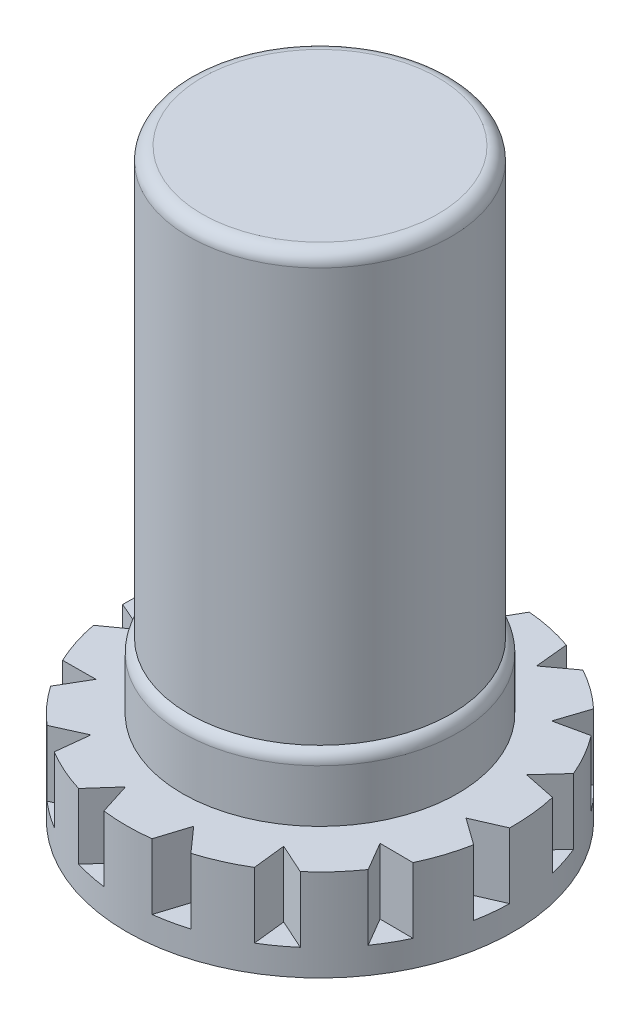
from build123d import *

# Parameters (mm, degrees)
ESBO_O1_R                = 2.95
RESSALTO_EXTRUS_O1_DEPTH = 1.4
CORTE_EXTRUS_O1_START    = -1
CORTE_EXTRUS_O1_DEPTH    = 1
ESBO_O3_R                = 2.1
RESSALTO_EXTRUS_O2_DEPTH = 1
FILETE3_R                = 0.2
ESBO_O4_R                = 2
RESSALTO_EXTRUS_O3_DEPTH = 6.5
FILETE4_R                = 0.2


with BuildPart() as part:
    # Esboço1 → Ressalto-extrusão1 (new body)
    with BuildSketch(Plane(origin=(0, 0, 0), x_dir=(1, 0, 0), z_dir=(0, 1, 0))):
        with Locations(Location((0, 0, 0), (0, 0, 270))):
            Circle(ESBO_O1_R)
    extrude(amount=RESSALTO_EXTRUS_O1_DEPTH)

    # Esboço2 → Corte-extrusão1 (cut)
    with BuildSketch(Plane(origin=(0, 1.4, 0), x_dir=(1, 0, 0), z_dir=(0, 1, 0)).offset(CORTE_EXTRUS_O1_START)):
        with BuildLine():
            Line((-0.25, 2.939387691), (0, 2.5))
            Line((0, 2.5), (0.25, 2.939387691))
            ThreePointArc((0.25, 2.939387691), (0, 2.95), (-0.25, 2.939387691))
        make_face()
        with BuildLine():
            Line((1.016841608, 2.283863644), (1.423943047, 2.583580113))
            ThreePointArc((1.423943047, 2.583580113), (1.199873097, 2.6949591), (0.967170318, 2.786948434))
            Line((0.967170318, 2.786948434), (1.016841608, 2.283863644))
        make_face()
        with BuildLine():
            Line((1.857862064, 1.672826516), (2.351673404, 1.781048062))
            ThreePointArc((2.351673404, 1.781048062), (2.192277235, 1.973935289), (2.017108101, 2.152620475))
            Line((2.017108101, 2.152620475), (1.857862064, 1.672826516))
        make_face()
        with BuildLine():
            Line((2.377641291, 0.772542486), (2.872778066, 0.670556621))
            ThreePointArc((2.872778066, 0.670556621), (2.805616723, 0.911600133), (2.718269569, 1.146084879))
            Line((2.718269569, 1.146084879), (2.377641291, 0.772542486))
        make_face()
        with BuildLine():
            Line((2.486304738, -0.261321158), (2.897153302, -0.555880152))
            ThreePointArc((2.897153302, -0.555880152), (2.933839591, -0.308358967), (2.949417534, -0.058619204))
            Line((2.949417534, -0.058619204), (2.486304738, -0.261321158))
        make_face()
        with BuildLine():
            Line((2.165063509, -1.25), (2.420584412, -1.686200197))
            ThreePointArc((2.420584412, -1.686200197), (2.554774941, -1.475), (2.670584412, -1.253187495))
            Line((2.670584412, -1.253187495), (2.165063509, -1.25))
        make_face()
        with BuildLine():
            Line((1.469463131, -2.022542486), (1.525474487, -2.524960908))
            ThreePointArc((1.525474487, -2.524960908), (1.733966494, -2.386600133), (1.929982984, -2.231068282))
            Line((1.929982984, -2.231068282), (1.469463131, -2.022542486))
        make_face()
        with BuildLine():
            Line((0.519779227, -2.445369002), (0.366596165, -2.927132941))
            ThreePointArc((0.366596165, -2.927132941), (0.613339488, -2.885535422), (0.855669965, -2.823177095))
            Line((0.855669965, -2.823177095), (0.519779227, -2.445369002))
        make_face()
        with BuildLine():
            Line((-0.519779227, -2.445369002), (-0.855669965, -2.823177095))
            ThreePointArc((-0.855669965, -2.823177095), (-0.613339488, -2.885535422), (-0.366596165, -2.927132941))
            Line((-0.366596165, -2.927132941), (-0.519779227, -2.445369002))
        make_face()
        with BuildLine():
            Line((-1.469463131, -2.022542486), (-1.929982984, -2.231068282))
            ThreePointArc((-1.929982984, -2.231068282), (-1.733966494, -2.386600133), (-1.525474487, -2.524960908))
            Line((-1.525474487, -2.524960908), (-1.469463131, -2.022542486))
        make_face()
        with BuildLine():
            Line((-2.165063509, -1.25), (-2.670584412, -1.253187495))
            ThreePointArc((-2.670584412, -1.253187495), (-2.554774941, -1.475), (-2.420584412, -1.686200197))
            Line((-2.420584412, -1.686200197), (-2.165063509, -1.25))
        make_face()
        with BuildLine():
            Line((-2.486304738, -0.261321158), (-2.949417534, -0.058619204))
            ThreePointArc((-2.949417534, -0.058619204), (-2.933839591, -0.308358967), (-2.897153302, -0.555880152))
            Line((-2.897153302, -0.555880152), (-2.486304738, -0.261321158))
        make_face()
        with BuildLine():
            Line((-2.377641291, 0.772542486), (-2.718269569, 1.146084879))
            ThreePointArc((-2.718269569, 1.146084879), (-2.805616723, 0.911600133), (-2.872778066, 0.670556621))
            Line((-2.872778066, 0.670556621), (-2.377641291, 0.772542486))
        make_face()
        with BuildLine():
            Line((-1.857862064, 1.672826516), (-2.017108101, 2.152620475))
            ThreePointArc((-2.017108101, 2.152620475), (-2.192277235, 1.973935289), (-2.351673404, 1.781048062))
            Line((-2.351673404, 1.781048062), (-1.857862064, 1.672826516))
        make_face()
        with BuildLine():
            Line((-1.016841608, 2.283863644), (-0.967170318, 2.786948434))
            ThreePointArc((-0.967170318, 2.786948434), (-1.199873097, 2.6949591), (-1.423943047, 2.583580113))
            Line((-1.423943047, 2.583580113), (-1.016841608, 2.283863644))
        make_face()
    extrude(amount=CORTE_EXTRUS_O1_DEPTH, mode=Mode.SUBTRACT)

    # Esboço3 → Ressalto-extrusão2 (add)
    with BuildSketch(Plane(origin=(0, 1.4, 0), x_dir=(1, 0, 0), z_dir=(0, 1, 0))):
        with Locations(Location((0, 0, 0), (0, 0, 270))):
            Circle(ESBO_O3_R)
    extrude(amount=RESSALTO_EXTRUS_O2_DEPTH)

    # Filete3
    filete3_edges = [part.edges().sort_by_distance(p)[0] for p in [
        (0, 2.4, -2.1),
    ]]
    fillet(filete3_edges, radius=FILETE3_R)

    # Esboço4 → Ressalto-extrusão3 (add)
    with BuildSketch(Plane(origin=(0, 2.4, 0), x_dir=(1, 0, 0), z_dir=(0, 1, 0))):
        with Locations(Location((0, 0, 0), (0, 0, 270))):
            Circle(ESBO_O4_R)
    extrude(amount=RESSALTO_EXTRUS_O3_DEPTH)

    # Filete4
    filete4_edges = [part.edges().sort_by_distance(p)[0] for p in [
        (0, 8.9, -2),
    ]]
    fillet(filete4_edges, radius=FILETE4_R)


solid = part.part
